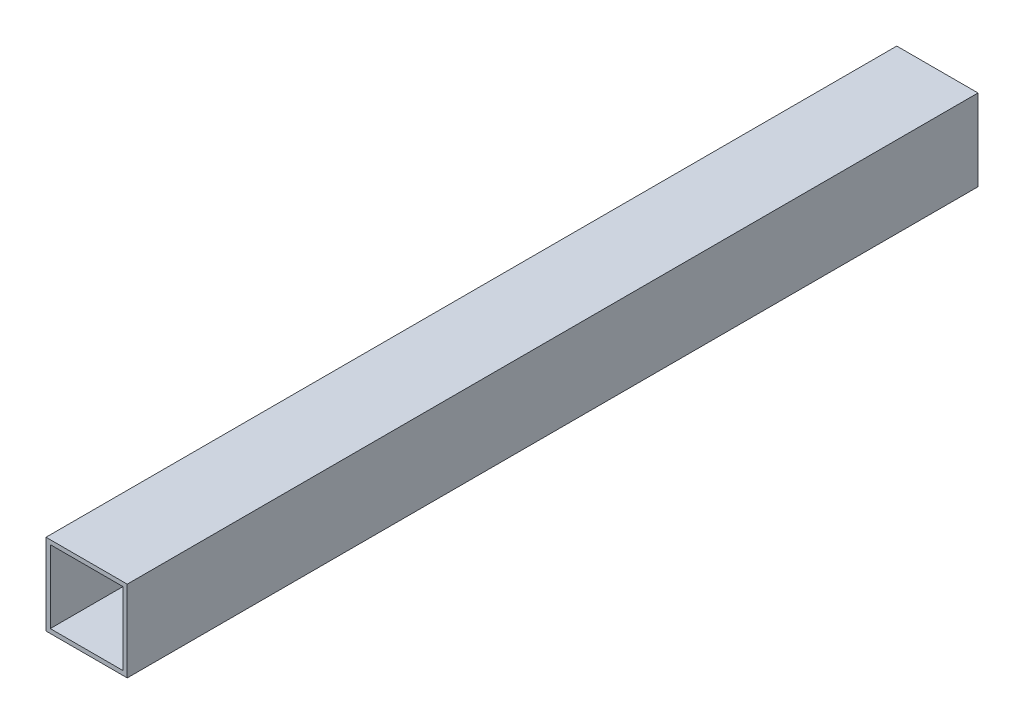
from build123d import *

# Parameters (mm, degrees)
SKETCH1_W           = 19.1
SKETCH1_H           = 19.1
SKETCH1_W_2         = 17.1
SKETCH1_H_2         = 17.1
BOSS_EXTRUDE1_DEPTH = 200


with BuildPart() as part:
    # Sketch1 → Boss-Extrude1 (new body)
    with BuildSketch(Plane.XY):
        with Locations((-7.273834197, -0.296891192)):
            Rectangle(SKETCH1_W, SKETCH1_H)
        with Locations((-7.273834197, -0.296891192)):
            Rectangle(SKETCH1_W_2, SKETCH1_H_2, mode=Mode.SUBTRACT)
    extrude(amount=BOSS_EXTRUDE1_DEPTH)


solid = part.part
